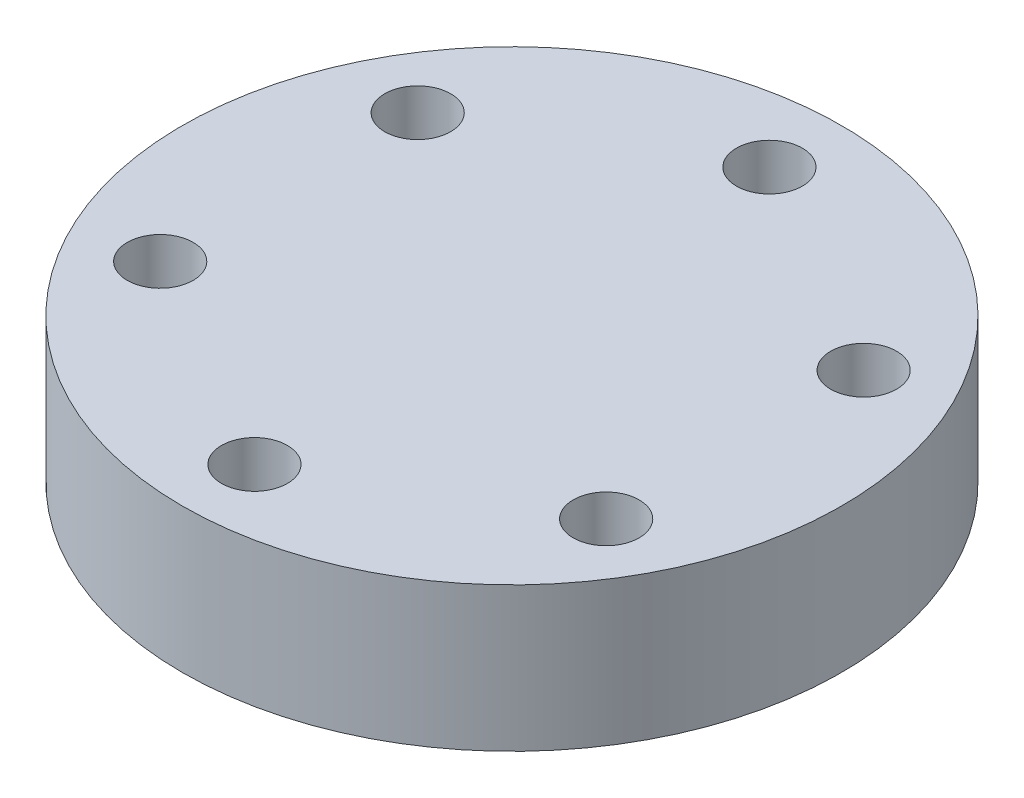
from build123d import *

# Parameters (mm, degrees)
SKETCH_1_R          = 16
EXTRUDE_1_DEPTH     = 5
SKETCH_2_R          = 16
EXTRUDE_2_DEPTH     = 2
SKETCH_3_R          = 1.6
CUT_EXTRUDE_1_DEPTH = 24.685438565


with BuildPart() as part:
    # 草图1 → 凸台-拉伸1 (new body)
    with BuildSketch(Plane(origin=(0, 0, 0), x_dir=(1, 0, 0), z_dir=(0, 1, 0))):
        with Locations(Location((0, 0, 0), (0, 0, 270))):
            Circle(SKETCH_1_R)
    extrude(amount=EXTRUDE_1_DEPTH)

    # 草图2 → 凸台-拉伸2 (add)
    with BuildSketch(Plane(origin=(0, 5, 0), x_dir=(1, 0, 0), z_dir=(0, 1, 0))):
        with Locations(Location((0, 0, 0), (0, 0, 270))):
            Circle(SKETCH_2_R)
    extrude(amount=EXTRUDE_2_DEPTH)

    # 草图3 → 切除-拉伸1 (cut, through all)
    with BuildSketch(Plane(origin=(0, 7, 0), x_dir=(1, 0, 0), z_dir=(0, 1, 0))):
        with Locations(Location((0, 12.5, 0), (0, 0, 270))):
            Circle(SKETCH_3_R)
        with Locations(Location((10.825317547, 6.25, 0), (0, 0, 270))):
            Circle(SKETCH_3_R)
        with Locations(Location((10.825317547, -6.25, 0), (0, 0, 270))):
            Circle(SKETCH_3_R)
        with Locations(Location((0, -12.5, 0), (0, 0, 270))):
            Circle(SKETCH_3_R)
        with Locations(Location((-10.825317547, -6.25, 0), (0, 0, 270))):
            Circle(SKETCH_3_R)
        with Locations(Location((-10.825317547, 6.25, 0), (0, 0, 270))):
            Circle(SKETCH_3_R)
    extrude(amount=-CUT_EXTRUDE_1_DEPTH, mode=Mode.SUBTRACT)


solid = part.part
